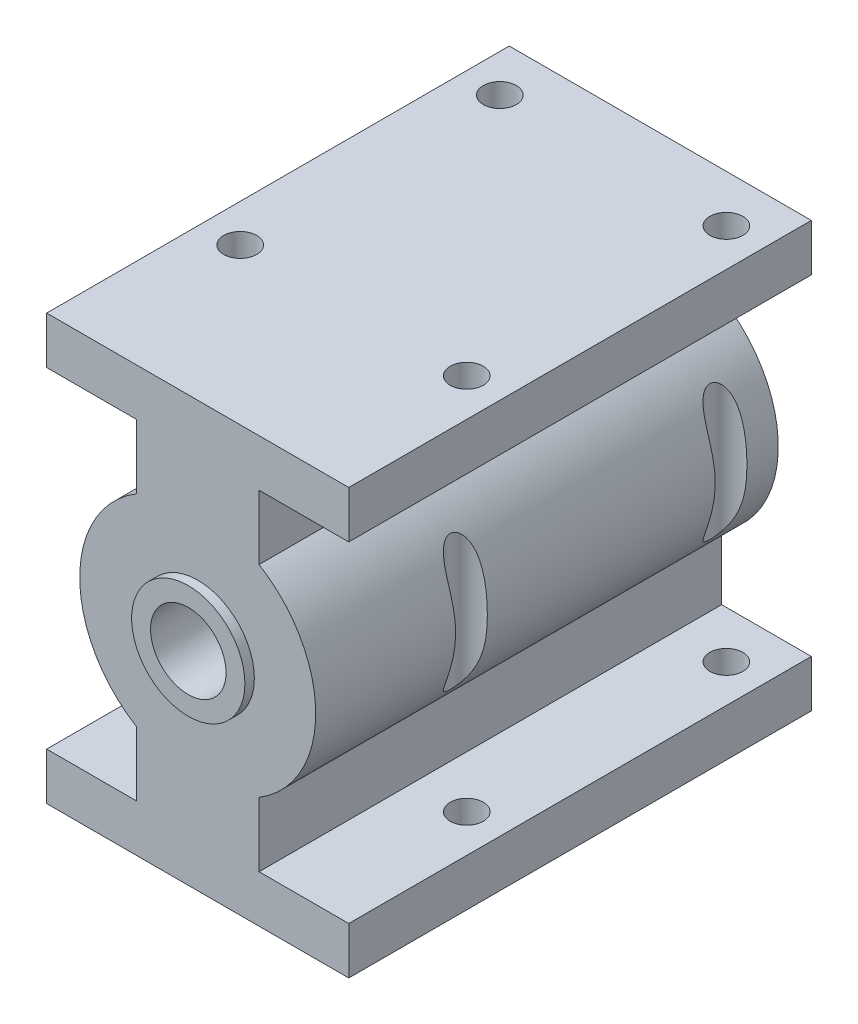
from build123d import *

# Parameters (mm, degrees)
BOSS_EXTRUDE1_DEPTH = 49
SKETCH2_R           = 4
CUT_EXTRUDE1_DEPTH  = 47
SKETCH7_W           = 32
SKETCH7_H           = 5
BOSS_EXTRUDE2_DEPTH = 49
SKETCH8_R           = 1.75
CUT_EXTRUDE4_DEPTH  = 69.425141578
BOSS_EXTRUDE3_START = 1
SKETCH9_R           = 6
SKETCH9_R_2         = 4
BOSS_EXTRUDE3_DEPTH = 1


with BuildPart() as part:
    # Sketch1 → Boss-Extrude1 (new body)
    with BuildSketch(Plane.XY):
        with BuildLine():
            Line((-6.5, 17.5), (6.5, 17.5))
            Line((6.5, 17.5), (6.5, 10.677078252))
            ThreePointArc((6.5, 10.677078252), (12.5, 0), (6.5, -10.677078252))
            Line((6.5, -10.677078252), (6.5, -17.5))
            Line((6.5, -17.5), (-6.5, -17.5))
            Line((-6.5, -17.5), (-6.5, -10.677078252))
            ThreePointArc((-6.5, -10.677078252), (-12.5, 0), (-6.5, 10.677078252))
            Line((-6.5, 10.677078252), (-6.5, 17.5))
        make_face()
    extrude(amount=BOSS_EXTRUDE1_DEPTH)

    # Sketch2 → Cut-Extrude1 (cut)
    with BuildSketch(Plane.XY.offset(49)):
        Circle(SKETCH2_R)
    extrude(amount=-CUT_EXTRUDE1_DEPTH, mode=Mode.SUBTRACT)

    # Sketch7 → Boss-Extrude2 (add)
    with BuildSketch(Plane.XY):
        with Locations((0, 20)):
            Rectangle(SKETCH7_W, SKETCH7_H)
        with Locations((0, -20)):
            Rectangle(SKETCH7_W, SKETCH7_H)
    extrude(amount=BOSS_EXTRUDE2_DEPTH)

    # Sketch8 → Cut-Extrude4 (cut, through all)
    with BuildSketch(Plane(origin=(0, 22.5, 0), x_dir=(1, 0, 0), z_dir=(0, 1, 0))):
        with Locations(Location((-12, -5, 0), (0, 0, 270))):
            Circle(SKETCH8_R)
        with Locations(Location((-12, -32.5, 0), (0, 0, 270))):
            Circle(SKETCH8_R)
        with Locations(Location((12, -32.5, 0), (0, 0, 270))):
            Circle(SKETCH8_R)
        with Locations(Location((12, -5, 0), (0, 0, 270))):
            Circle(SKETCH8_R)
    extrude(amount=-CUT_EXTRUDE4_DEPTH, mode=Mode.SUBTRACT)

    # Sketch9 → Boss-Extrude3 (add)
    with BuildSketch(Plane.XY.offset(49).offset(BOSS_EXTRUDE3_START)):
        Circle(SKETCH9_R)
        Circle(SKETCH9_R_2, mode=Mode.SUBTRACT)
    extrude(amount=-BOSS_EXTRUDE3_DEPTH)


solid = part.part
